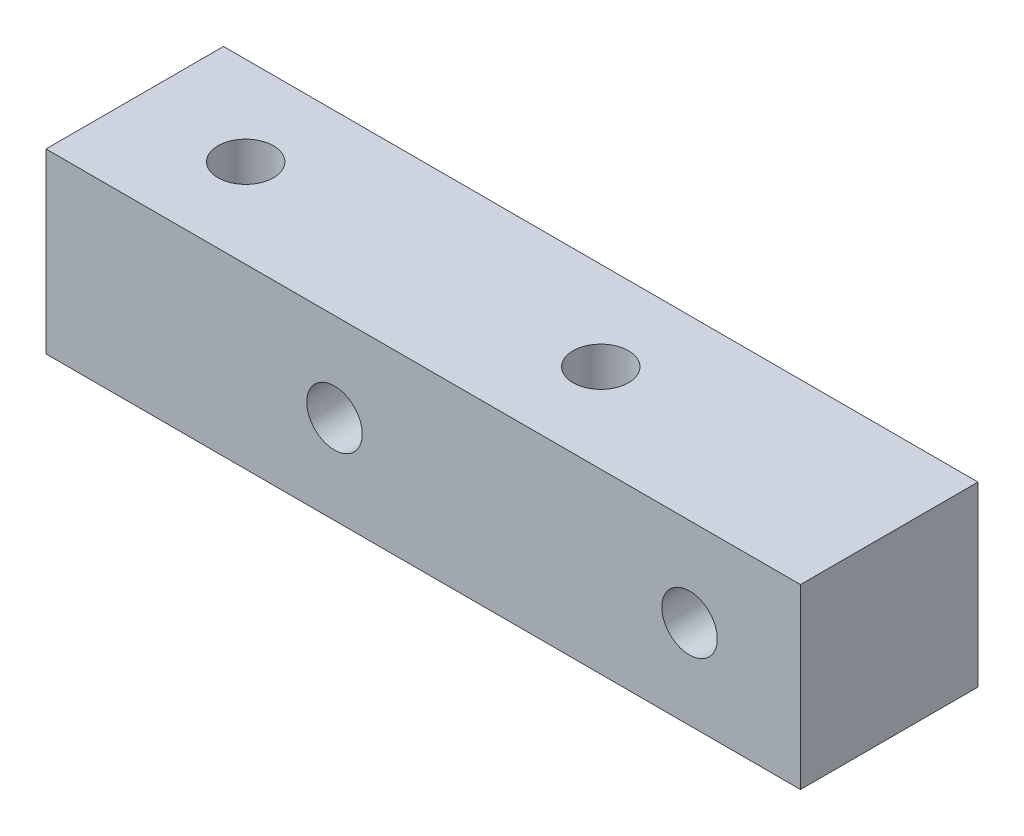
from build123d import *

# Parameters (mm, degrees)
SKETCH_1_W                   = 34
SKETCH_1_H                   = 8
EXTRUDE_1_DEPTH              = 8
HOLE_WIZARD_M3_1_D           = 2.5
HOLE_WIZARD_M3_1_ON_FACE_2_D = 2.5


with BuildPart() as part:
    # 草图1 → 凸台-拉伸1 (new body)
    with BuildSketch(Plane.XY):
        Rectangle(SKETCH_1_W, SKETCH_1_H)
    extrude(amount=EXTRUDE_1_DEPTH)

    # M3 螺纹孔的螺纹孔钻头1 (through all)
    with Locations(Plane(origin=(4, 4, 4), x_dir=(1, 0, 0), z_dir=(0, 1, 0))):
        with Locations((0, 0), (-16, 0)):
            Hole(HOLE_WIZARD_M3_1_D / 2)

    # M3 螺纹孔的螺纹孔钻头1 on face 2 (through all)
    with Locations(Plane(origin=(-4, 0, 0), x_dir=(-1, 0, 0), z_dir=(0, 0, -1))):
        with Locations((0, 0), (-16, 0)):
            Hole(HOLE_WIZARD_M3_1_ON_FACE_2_D / 2)


solid = part.part
